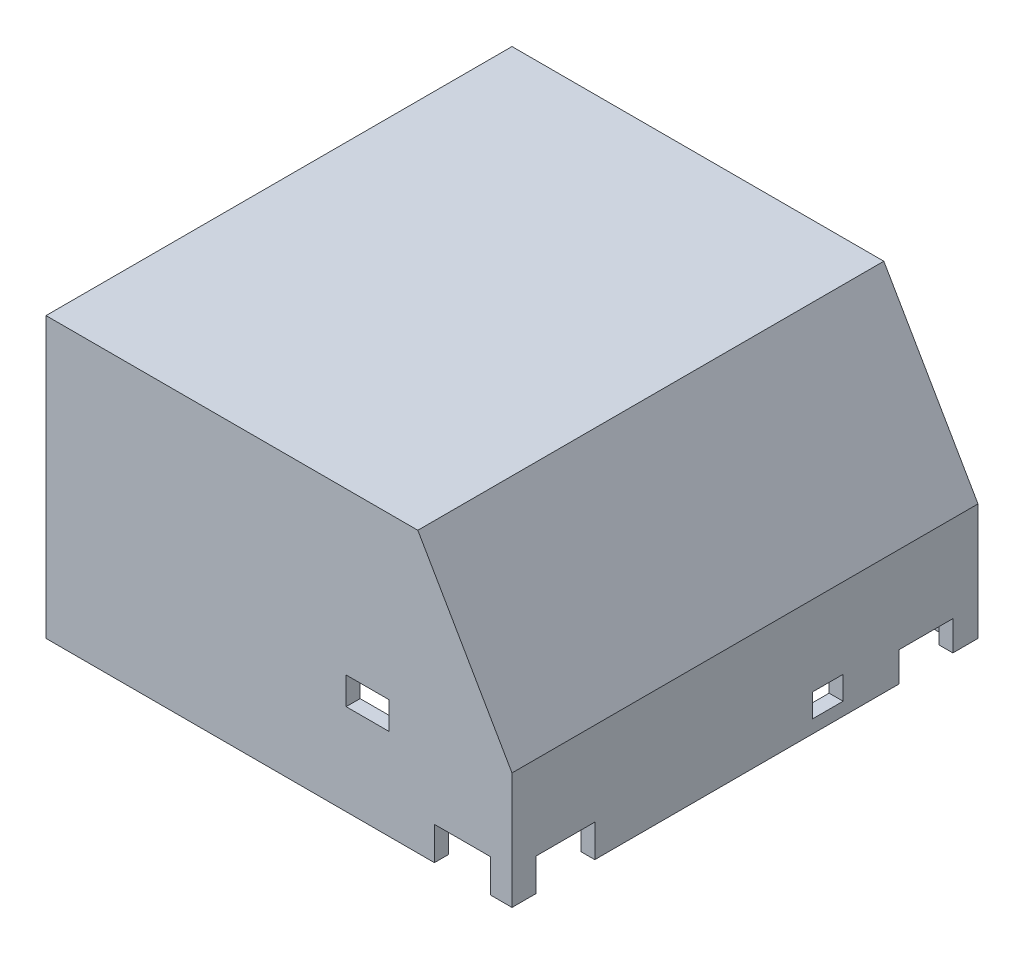
from build123d import *

# Parameters (mm, degrees)
BOSS_EXTRUDE1_DEPTH = 100
SHELL1_T            = -3
SKETCH2_W           = 56.015644735
SKETCH2_H           = 35
CUT_EXTRUDE1_DEPTH  = 10
SKETCH3_W           = 12.606592538
SKETCH3_H           = 6.980178381
SKETCH3_W_2         = 11.515112664
SKETCH3_H_2         = 6.37986445
CUT_EXTRUDE2_DEPTH  = 10
SKETCH4_W           = 9.169229256
SKETCH4_H           = 5.894504522
CUT_EXTRUDE3_DEPTH  = 10
SKETCH5_W           = 6.776014824
SKETCH5_H           = 5.054240566
CUT_EXTRUDE4_DEPTH  = 10
SKETCH6_W           = 11.990530565
SKETCH6_H           = 7.12730724
CUT_EXTRUDE5_DEPTH  = 10
SKETCH8_W           = 6.563036955
SKETCH8_H           = 5.005706152
CUT_EXTRUDE6_DEPTH  = 10


with BuildPart() as part:
    # Sketch1 → Boss-Extrude1 (new body)
    with BuildSketch(Plane.XY):
        Polygon((-50, 12.5), (-50, 47.5), (29.792740578, 47.5), (50, 12.5), (50, -12.5), (-50, -12.5), align=None)
    extrude(amount=BOSS_EXTRUDE1_DEPTH)

    # Shell1
    shell1_openings = [part.faces().sort_by_distance(p)[0] for p in [
        (0, -12.5, 50),
    ]]
    offset(amount=SHELL1_T, openings=shell1_openings, kind=Kind.INTERSECTION)

    # Sketch2 → Cut-Extrude1 (cut)
    with BuildSketch(Plane.ZY.offset(50)):
        with Locations((51.884685058, 5)):
            Rectangle(SKETCH2_W, SKETCH2_H)
    extrude(amount=-CUT_EXTRUDE1_DEPTH, mode=Mode.SUBTRACT)

    # Sketch3 → Cut-Extrude2 (cut)
    with BuildSketch(Plane(origin=(50, 0, 0), x_dir=(0, 0, -1), z_dir=(1, 0, 0))):
        with Locations((-88.542199405, -9.009910809)):
            Rectangle(SKETCH3_W, SKETCH3_H)
        with Locations((-11.156276384, -9.310067775)):
            Rectangle(SKETCH3_W_2, SKETCH3_H_2)
    extrude(amount=-CUT_EXTRUDE2_DEPTH, mode=Mode.SUBTRACT)

    # Sketch4 → Cut-Extrude3 (cut)
    with BuildSketch(Plane.XY.offset(100)):
        with Locations((18.993403459, 9.968133111)):
            Rectangle(SKETCH4_W, SKETCH4_H)
    extrude(amount=-CUT_EXTRUDE3_DEPTH, mode=Mode.SUBTRACT)

    # Sketch5 → Cut-Extrude4 (cut)
    with BuildSketch(Plane.ZY.offset(50)):
        with Locations((8.609898129, -7.132480119)):
            Rectangle(SKETCH5_W, SKETCH5_H)
        with Locations((91.390101871, -7.132480119)):
            Rectangle(SKETCH5_W, SKETCH5_H)
    extrude(amount=-CUT_EXTRUDE4_DEPTH, mode=Mode.SUBTRACT)

    # Sketch6 → Cut-Extrude5 (cut)
    with BuildSketch(Plane.XY.offset(100)):
        with Locations((39.347077193, -8.93634638)):
            Rectangle(SKETCH6_W, SKETCH6_H)
    extrude(amount=-CUT_EXTRUDE5_DEPTH, mode=Mode.SUBTRACT)

    # Sketch8 → Cut-Extrude6 (cut)
    with BuildSketch(Plane(origin=(50, 0, 0), x_dir=(0, 0, -1), z_dir=(1, 0, 0))):
        with Locations((-32.231091097, -7.194817018)):
            Rectangle(SKETCH8_W, SKETCH8_H)
    extrude(amount=-CUT_EXTRUDE6_DEPTH, mode=Mode.SUBTRACT)


solid = part.part
